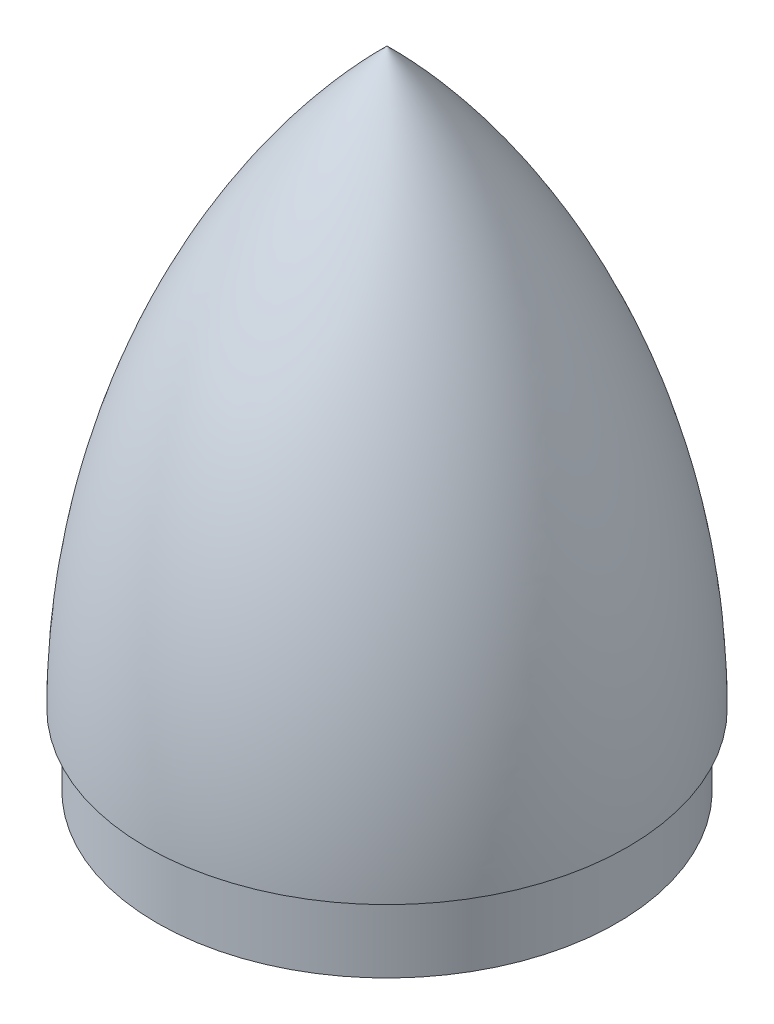
from build123d import *


with BuildPart() as part:
    # Sketch1 → Revolve1 (revolve)
    with BuildSketch(Plane(origin=(0, 0, 0), x_dir=(0, 1, 0), z_dir=(0, 0, 1)), mode=Mode.PRIVATE) as revolve1_sk:
        with BuildLine():
            Line((0, 41.1), (12.7, 41.1))
            Line((12.7, 41.1), (12.7, 43))
            ThreePointArc((12.7, 43), (68.277086106, 31.814565717), (115.2, 0))
            Line((115.2, 0), (113.793613075, 0))
            ThreePointArc((113.793613075, 0), (78.00392469, 26.176324988), (35.906026182, 40.1))
            Line((35.906026182, 40.1), (13.7, 40.1))
            Line((13.7, 40.1), (0, 40.1))
            Line((0, 40.1), (0, 41.1))
        make_face()
    revolve(revolve1_sk.sketch.rotate(Axis((0, -1000, 0), (0, 1, 0)), 270), axis=Axis((0, -1000, 0), (0, 1, 0)))


solid = part.part
